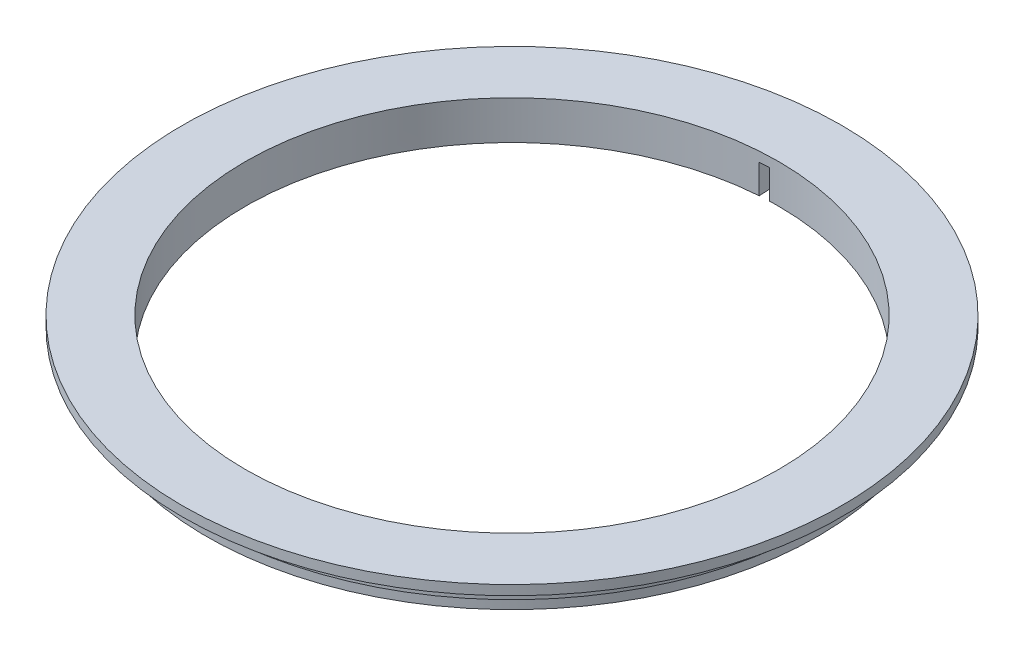
from build123d import *

# Parameters (mm, degrees)
ENL_V_MAT_EXTRU_1_DEPTH = 20.395702365


with BuildPart() as part:
    # Esquisse1 → Révolution1 (revolve)
    with BuildSketch(Plane.XY, mode=Mode.PRIVATE) as r_volution1_sk:
        Polygon((157.568040745, 0), (157.568040745, 5), (158.36383893, 5), (158.36383893, 10), (159.159637116, 10), (159.159637116, 15), (170, 15), (170, 20), (137.568040745, 20), (137.568040745, 0), align=None)
    revolve(r_volution1_sk.sketch.rotate(Axis((0, 0, 0), (0, 1, 0)), 90), axis=Axis((0, 0, 0), (0, 1, 0)))

    # Esquisse2 → Enlèv. mat.-Extru.1 (cut)
    with BuildSketch(Plane.XZ.offset(-15)):
        Polygon((-9.406937207, -131.726748145), (-11.551478732, -172.647038111), (-6.558331058, -172.908717892), (-4.413789534, -131.988427927), align=None)
    extrude(amount=ENL_V_MAT_EXTRU_1_DEPTH, mode=Mode.SUBTRACT)


solid = part.part
